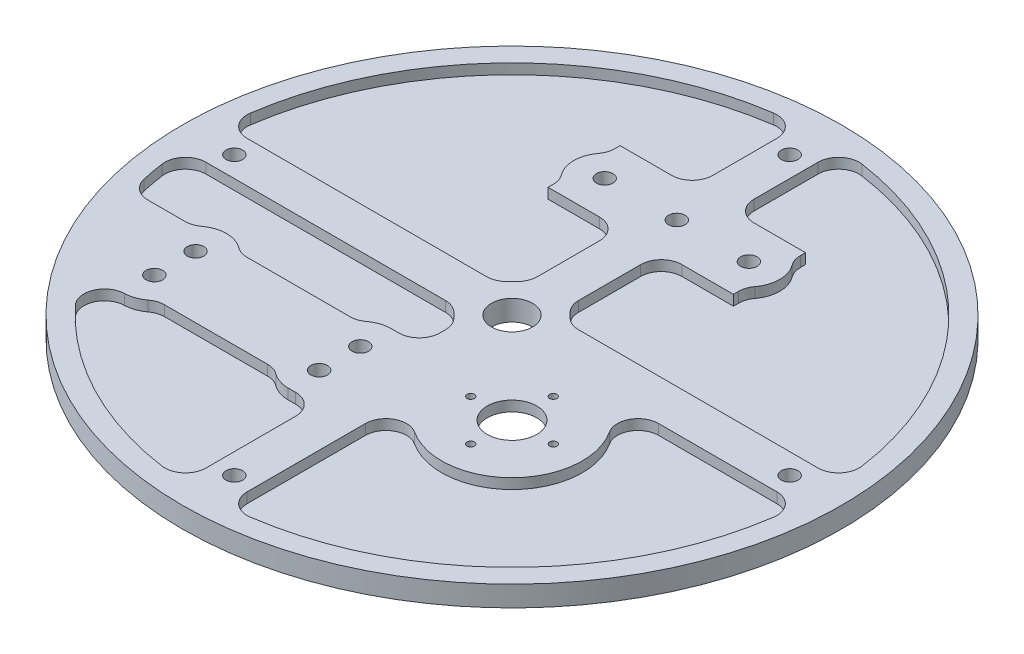
from build123d import *

# Parameters (mm, degrees)
SKETCH3_R                   = 101.6
BOSS_EXTRUDE1_DEPTH         = 6.35
SKETCH4_R                   = 7.620000000000008
CUT_EXTRUDE1_DEPTH          = 144.82434599190776
F_1_4_20_TAPPED_HOLE5_D     = 5.1054
F_1_4_20_TAPPED_HOLE5_DEPTH = 19.05
F_1_4_20_TAPPED_HOLE5_TIP   = 1.5338169021916532
CUT_EXTRUDE2_DEPTH          = 3.175
F_1_4_20_TAPPED_HOLE2_D     = 5.1054
F_1_4_20_TAPPED_HOLE2_DEPTH = 19.05
F_1_4_20_TAPPED_HOLE2_TIP   = 1.5338169021916532
F_1_4_20_TAPPED_HOLE4_D     = 5.1054
F_1_4_20_TAPPED_HOLE4_DEPTH = 19.05
F_1_4_20_TAPPED_HOLE4_TIP   = 1.5338169021916532
FILLET3_R                   = 6.35
F_4_40_TAPPED_HOLE1_D       = 2.2606
CUT_EXTRUDE3_DEPTH          = 3.175
FILLET4_R                   = 6.35


with BuildPart() as part:
    # Sketch3 → Boss-Extrude1 (new body)
    with BuildSketch(Plane(origin=(0, 0, 0), x_dir=(1, 0, 0), z_dir=(0, 1, 0))):
        with Locations(Location((0, 0, 0), (0, 0, 270))):
            Circle(SKETCH3_R)
    extrude(amount=BOSS_EXTRUDE1_DEPTH)

    # Sketch4 → Cut-Extrude1 (cut, through all)
    with BuildSketch(Plane(origin=(0, 6.35, 0), x_dir=(1, 0, 0), z_dir=(0, 1, 0))):
        with BuildLine():
            ThreePointArc((2.703e-14, -6.349999999999998), (4.490128060534583, -4.490128060534569), (6.349999999999998, -1.56e-15))
            Line((6.349999999999994, 0), (0, 0))
            Line((0, 0), (0, -6.349999999999994))
        make_face()
        with BuildLine():
            Line((0, 0), (6.349999999999994, 0))
            ThreePointArc((6.349999999999998, 0), (-4.490128060534585, 4.490128060534566), (2.703e-14, -6.349999999999998))
            Line((0, -6.349999999999994), (0, 0))
        make_face()
        with Locations(Location((28.06330037834144, -28.063300378340767, 0), (0, 0, 270))):
            Circle(SKETCH4_R)
    extrude(amount=-CUT_EXTRUDE1_DEPTH, mode=Mode.SUBTRACT)

    # 1/4-20 Tapped Hole5
    with Locations(Plane(origin=(0, 6.35, -85.599778), x_dir=(0, 0, 1), z_dir=(0, 1, 0))):
        with Locations((0, 0), (85.599778, -85.599778), (171.199556, 0), (85.599778, 85.599778)):
            Hole(F_1_4_20_TAPPED_HOLE5_D / 2, depth=F_1_4_20_TAPPED_HOLE5_DEPTH)
            with Locations((0, 0, -(F_1_4_20_TAPPED_HOLE5_DEPTH + F_1_4_20_TAPPED_HOLE5_TIP / 2))):  # 118° drill point
                Cone(0, F_1_4_20_TAPPED_HOLE5_D / 2, F_1_4_20_TAPPED_HOLE5_TIP, mode=Mode.SUBTRACT)

    # Sketch6 → Cut-Extrude2 (cut)
    with BuildSketch(Plane(origin=(0, 6.35, 0), x_dir=(1, 0, 0), z_dir=(0, 1, 0))):
        with BuildLine():
            Line((-28.575000000000006, 61.9125), (-6.349999999999998, 61.912500000000016))
            Line((-6.349999999999998, 61.912500000000016), (-6.350000000000037, 95.03809762405811))
            ThreePointArc((-6.350000000000033, 95.03809762405811), (-67.35192090801853, 67.35192090801877), (-95.03809762405808, 6.350000000000408))
            Line((-95.03809762405807, 6.350000000000351), (-10.998522628062574, 6.349999999999822))
            ThreePointArc((-10.998522628062497, 6.349999999999779), (-8.980256121069209, 8.980256121069099), (-6.349999999999914, 10.99852262806242))
            Line((-6.349999999999998, 10.99852262806245), (-6.349999999999998, 39.687499999999986))
            Line((-6.349999999999998, 39.687499999999986), (-28.575, 39.687499999999986))
            Line((-28.575, 39.687499999999986), (-28.575, 43.70048417143843))
            ThreePointArc((-28.575000000000216, 43.700484171438355), (-31.750000000000014, 50.80000000000001), (-28.57500000000022, 57.89951582856166))
            Line((-28.575000000000006, 57.89951582856159), (-28.575000000000006, 61.9125))
        make_face()
        with BuildLine():
            Line((6.350000000002216, 95.03809762405781), (6.349999999999998, 61.91250000000002))
            Line((6.349999999999998, 61.91250000000002), (28.575000000000028, 61.91250000000004))
            Line((28.575000000000028, 61.91250000000004), (28.575000000000028, 57.89951582856217))
            ThreePointArc((28.574999999999754, 57.89951582856208), (31.75000000000002, 50.80000000000001), (28.57499999999976, 43.700484171437935))
            Line((28.575000000000035, 43.70048417143784), (28.575000000000035, 39.687499999999986))
            Line((28.575000000000035, 39.687499999999986), (6.349999999999998, 39.687499999999986))
            Line((6.349999999999998, 39.687499999999986), (6.349999999999998, 10.998522628062325))
            ThreePointArc((6.350000000000048, 10.998522628062343), (8.980256121069322, 8.980256121068983), (10.998522628062583, 6.349999999999632))
            Line((10.998522628062709, 6.349999999999706), (95.03809762405771, 6.350000000002941))
            ThreePointArc((95.03809762405791, 6.3500000000029555), (67.35192090801839, 67.35192090801893), (6.350000000002218, 95.03809762405797))
        make_face()
        with BuildLine():
            ThreePointArc((-6.349999999999907, -10.998522628062423), (-8.980256121069205, -8.9802561210691), (-10.9985226280625, -6.349999999999777))
            Line((-10.998522628062572, -6.349999999999824), (-95.03809762405797, -6.350000000001099))
            ThreePointArc((-95.03809762405804, -6.350000000001103), (-93.90381775371628, -15.957302756946103), (-91.8008850719861, -25.399999999999988))
            Line((-91.8008850719861, -25.400000000000006), (-72.9109158285621, -25.400000000000006))
            ThreePointArc((-72.91091582856204, -25.400000000000183), (-65.81140000000006, -22.22499999999998), (-58.71188417143806, -25.400000000000126))
            Line((-58.71188417143801, -25.400000000000084), (-22.110915828561872, -25.400000000000006))
            ThreePointArc((-22.110915828561865, -25.400000000000006), (-18.899964966668318, -23.054904399605476), (-15.011400000000005, -22.22499999999998))
            Line((-15.011400000000005, -22.22499999999998), (-6.349999999999998, -22.22499999999998))
            Line((-6.349999999999998, -22.22499999999998), (-6.349999999999998, -10.998522628062457))
        make_face()
        with BuildLine():
            Line((95.03809762405827, -6.349999999998817), (28.063300378341538, -6.350000000000001))
            ThreePointArc((28.063300378341545, -6.350000000000005), (43.41692231780658, -43.416922317805984), (6.35000000000068, -28.063300378340763))
            Line((6.350000000000339, -28.063300378340763), (6.3500000000001044, -95.03809762405808))
            ThreePointArc((6.350000000000042, -95.03809762405811), (67.35192090801905, -67.35192090801824), (95.0380976240582, -6.349999999998817))
        make_face()
        with BuildLine():
            Line((-65.81140000000002, -53.97499999999998), (-78.48096504885757, -53.97499999999998))
            ThreePointArc((-78.48096504885758, -53.97499999999996), (-47.123429994015716, -82.77647519433948), (-6.350000000001006, -95.03809762405804))
            Line((-6.350000000000966, -95.03809762405798), (-6.349999999999998, -53.97499999999998))
            Line((-6.349999999999998, -53.97499999999998), (-15.011400000000005, -53.97499999999998))
            ThreePointArc((-15.011400000000007, -53.97499999999998), (-18.8999649666683, -53.14509560039449), (-22.11091582856184, -50.79999999999998))
            Line((-22.110915828561843, -50.79999999999998), (-58.71188417143799, -50.799999999999876))
            ThreePointArc((-58.71188417143805, -50.79999999999983), (-61.92283503333163, -53.14509560039445), (-65.81140000000002, -53.97499999999998))
        make_face()
    extrude(amount=-CUT_EXTRUDE2_DEPTH, mode=Mode.SUBTRACT)

    # 1/4-20 Tapped Hole2
    with Locations(Plane(origin=(-22.225, 6.35, -50.8), x_dir=(0, 0, 1), z_dir=(0, 1, 0))):
        with Locations((0, 0), (0, 44.45), (0, 22.225)):
            Hole(F_1_4_20_TAPPED_HOLE2_D / 2, depth=F_1_4_20_TAPPED_HOLE2_DEPTH)
            with Locations((0, 0, -(F_1_4_20_TAPPED_HOLE2_DEPTH + F_1_4_20_TAPPED_HOLE2_TIP / 2))):  # 118° drill point
                Cone(0, F_1_4_20_TAPPED_HOLE2_D / 2, F_1_4_20_TAPPED_HOLE2_TIP, mode=Mode.SUBTRACT)

    # 1/4-20 Tapped Hole4
    with Locations(Plane(origin=(-65.8114, 6.35, 31.75), x_dir=(0, 0, 1), z_dir=(0, 1, 0))):
        with Locations((0, 0), (12.7, 0), (12.7, 50.8), (0, 50.8)):
            Hole(F_1_4_20_TAPPED_HOLE4_D / 2, depth=F_1_4_20_TAPPED_HOLE4_DEPTH)
            with Locations((0, 0, -(F_1_4_20_TAPPED_HOLE4_DEPTH + F_1_4_20_TAPPED_HOLE4_TIP / 2))):  # 118° drill point
                Cone(0, F_1_4_20_TAPPED_HOLE4_D / 2, F_1_4_20_TAPPED_HOLE4_TIP, mode=Mode.SUBTRACT)

    # Fillet3
    fillet3_edges = [part.edges().sort_by_distance(p)[0] for p in [
        (-10.998522628062535, 4.762499999999999, 6.349999999999799),
        (-6.349999999999952, 4.762499999999999, 10.998522628062439),
        (-6.3500000000009855, 4.762499999999999, 95.038097624058),
        (-95.03809762405801, 4.762499999999999, 6.350000000001101),
        (95.03809762405824, 4.762499999999999, 6.349999999998815),
        (6.350000000000073, 4.762499999999999, 95.0380976240581),
        (95.03809762405783, 4.762499999999999, -6.350000000002949),
        (10.998522628062645, 4.762499999999999, -6.349999999999669),
        (6.350000000000022, 4.762499999999999, -10.998522628062334),
        (6.349999999999998, 4.762499999999999, -39.687499999999986),
        (6.349999999999998, 4.762499999999999, -61.91250000000002),
        (6.35000000000222, 4.762499999999999, -95.0380976240579),
        (-6.350000000000035, 4.762499999999999, -95.03809762405811),
        (-95.03809762405808, 4.762499999999999, -6.350000000000376),
        (-10.998522628062535, 4.762499999999999, -6.349999999999801),
        (-6.349999999999955, 4.762499999999999, -10.998522628062435),
        (-6.349999999999998, 4.762499999999999, -39.687499999999986),
        (28.06330037834154, 4.762499999999999, 6.350000000000007),
        (6.350000000000506, 4.762499999999999, 28.06330037834077),
        (-6.349999999999998, 4.762499999999999, -61.912500000000016),
        (-72.91091582856207, 4.762499999999999, 25.400000000000095),
        (-58.71188417143803, 4.762499999999999, 25.400000000000105),
        (-22.110915828561843, 4.762499999999999, 50.79999999999998),
        (-22.11091582856187, 4.762499999999999, 25.400000000000006),
        (-28.575000000000117, 4.762499999999999, -57.899515828561626),
        (-28.57500000000011, 4.762499999999999, -43.70048417143839),
        (28.574999999999896, 4.762499999999999, -43.70048417143789),
        (28.57499999999989, 4.762499999999999, -57.89951582856213),
        (-91.80088507198612, 4.762499999999999, 25.399999999999995),
        (-58.711884171438015, 4.762499999999999, 50.799999999999855),
        (-78.48096504885758, 4.762499999999999, 53.97499999999998),
        (-6.349999999999998, 4.762499999999999, 22.22499999999998),
        (-6.349999999999998, 4.762499999999999, 53.97499999999998),
    ]]
    fillet(fillet3_edges, radius=FILLET3_R)

    # #4-40 Tapped Hole1 (through all)
    with Locations(Plane(origin=(28.063300378, 6.35, 15.335360378), x_dir=(0, 0, 1), z_dir=(0, 1, 0))):
        with Locations((0, 0), (12.72794, -12.72794), (25.45588, 0), (12.72794, 12.72794)):
            Hole(F_4_40_TAPPED_HOLE1_D / 2)

    # Sketch15 → Cut-Extrude3 (cut)
    with BuildSketch(Plane.XZ):
        with BuildLine():
            Line((40.79124037834144, 23.300800378340764), (32.82580037834144, 15.335360378340768))
            ThreePointArc((32.82580037834144, 15.335360378340768), (28.06330037834144, 10.572860378340765), (23.30080037834144, 15.335360378340768))
            Line((23.30080037834144, 15.335360378340768), (15.335360378341441, 23.300800378340767))
            ThreePointArc((15.335360378341441, 23.300800378340767), (10.572860378341442, 28.063300378340767), (15.335360378341441, 32.825800378340766))
            Line((15.335360378341441, 32.825800378340766), (23.30080037834144, 40.79124037834077))
            ThreePointArc((23.30080037834144, 40.79124037834077), (28.06330037834144, 45.55374037834076), (32.82580037834144, 40.79124037834077))
            Line((32.82580037834144, 40.79124037834077), (40.79124037834144, 32.82580037834077))
            ThreePointArc((40.79124037834144, 32.82580037834077), (45.553740378341445, 28.063300378340767), (40.79124037834144, 23.300800378340764))
        make_face()
    extrude(amount=-CUT_EXTRUDE3_DEPTH, mode=Mode.SUBTRACT)

    # Fillet4
    fillet4_edges = [part.edges().sort_by_distance(p)[0] for p in [
        (23.30080037834144, 1.5875, 40.79124037834077),
        (15.335360378341441, 1.5875, 32.825800378340766),
        (15.335360378341441, 1.5875, 23.300800378340767),
        (23.300800378341435, 1.5875, 15.335360378340768),
        (32.82580037834144, 1.5875, 15.335360378340768),
        (40.79124037834144, 1.5875, 23.300800378340767),
        (40.79124037834144, 1.5875, 32.82580037834077),
        (32.82580037834144, 1.5875, 40.79124037834077),
    ]]
    fillet(fillet4_edges, radius=FILLET4_R)


solid = part.part
